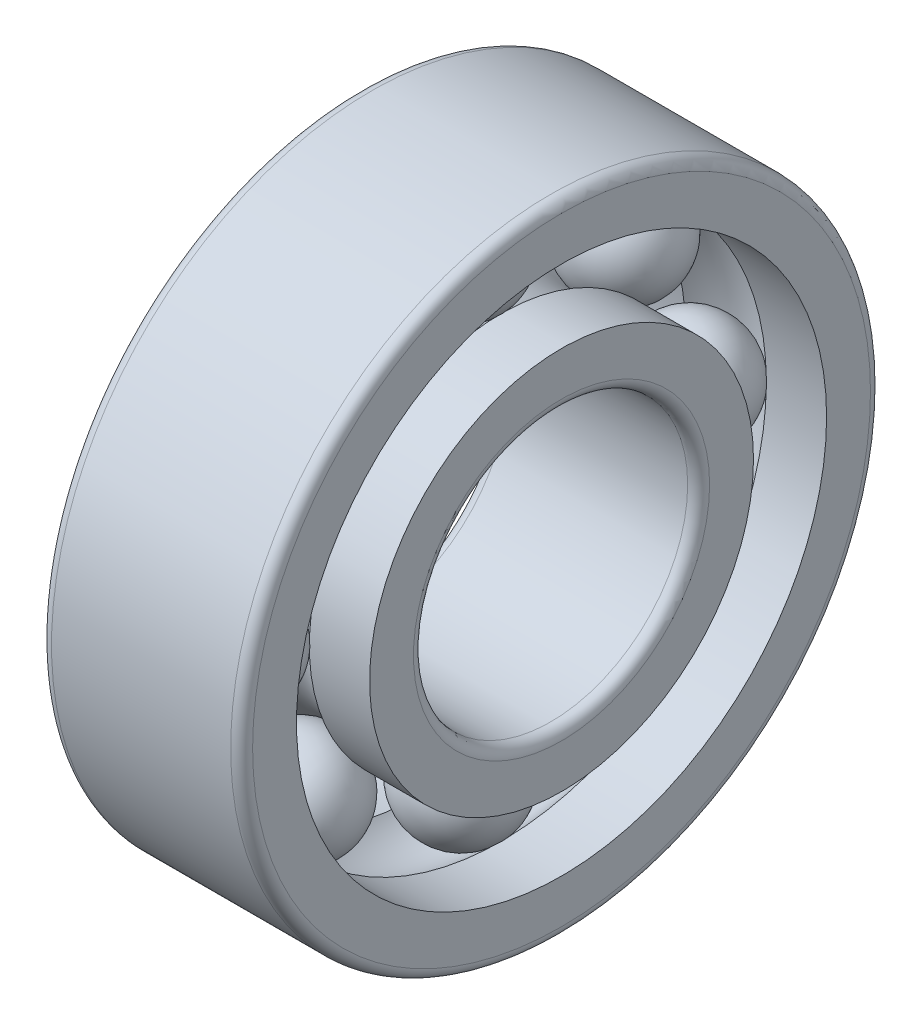
from build123d import *

# Parameters (mm, degrees)
R_P_TITION_CIRCULAIRE1_COUNT = 8


with BuildPart() as part:
    # BalDetSke → BallDetailed (revolve)
    with BuildSketch(Plane.XY):
        with BuildLine():
            Line((-3, 12.5), (3, 12.5))
            ThreePointArc((3, 12.5), (0, 9.5), (-3, 12.5))
        make_face()
    revolve(axis=Axis((-1.905, 12.5, 0), (1, 0, 0)))


with BuildPart() as body_2:
    # InnRacSke → InnerRace (revolve)
    with BuildSketch(Plane.XY):
        with BuildLine():
            Line((-2.202413449, 10.5), (-5.5, 10.5))
            Line((-5.5, 10.5), (-5.5, 8.1))
            ThreePointArc((-5.5, 8.1), (-5.324264069, 7.675735931), (-4.9, 7.5))
            Line((-4.9, 7.5), (4.9, 7.5))
            ThreePointArc((4.9, 7.5), (5.324264069, 7.675735931), (5.5, 8.1))
            Line((5.5, 8.1), (5.5, 10.5))
            Line((5.5, 10.5), (2.202413449, 10.5))
            ThreePointArc((2.202413449, 10.5), (0, 9.525), (-2.202413449, 10.5))
        make_face()
    revolve(axis=Axis((-20.6375, 0, 0), (1, 0, 0)))


with BuildPart() as body_3:
    # OutRacSke → OuterRace (revolve)
    with BuildSketch(Plane.XY):
        with BuildLine():
            Line((-2.202413449, 14.5), (-5.5, 14.5))
            Line((-5.5, 14.5), (-5.5, 16.9))
            ThreePointArc((-5.5, 16.9), (-5.324264069, 17.324264069), (-4.9, 17.5))
            Line((-4.9, 17.5), (4.9, 17.5))
            ThreePointArc((4.9, 17.5), (5.324264069, 17.324264069), (5.5, 16.9))
            Line((5.5, 16.9), (5.5, 14.5))
            Line((5.5, 14.5), (2.202413449, 14.5))
            ThreePointArc((2.202413449, 14.5), (0, 15.475), (-2.202413449, 14.5))
        make_face()
    revolve(axis=Axis((-20.6375, 0, 0), (1, 0, 0)))


with BuildPart() as r_p_tition_circulaire1_1:
    # Répétition circulaire1: pattern copy
    add(part.part.rotate(Axis((-20.6375, 0, 0), (1, 0, 0)), 1 * 360 / R_P_TITION_CIRCULAIRE1_COUNT))


with BuildPart() as r_p_tition_circulaire1_2:
    # Répétition circulaire1: pattern copy
    add(part.part.rotate(Axis((-20.6375, 0, 0), (1, 0, 0)), 2 * 360 / R_P_TITION_CIRCULAIRE1_COUNT))


with BuildPart() as r_p_tition_circulaire1_3:
    # Répétition circulaire1: pattern copy
    add(part.part.rotate(Axis((-20.6375, 0, 0), (1, 0, 0)), 3 * 360 / R_P_TITION_CIRCULAIRE1_COUNT))


with BuildPart() as r_p_tition_circulaire1_4:
    # Répétition circulaire1: pattern copy
    add(part.part.rotate(Axis((-20.6375, 0, 0), (1, 0, 0)), 4 * 360 / R_P_TITION_CIRCULAIRE1_COUNT))


with BuildPart() as r_p_tition_circulaire1_5:
    # Répétition circulaire1: pattern copy
    add(part.part.rotate(Axis((-20.6375, 0, 0), (1, 0, 0)), 5 * 360 / R_P_TITION_CIRCULAIRE1_COUNT))


with BuildPart() as r_p_tition_circulaire1_6:
    # Répétition circulaire1: pattern copy
    add(part.part.rotate(Axis((-20.6375, 0, 0), (1, 0, 0)), 6 * 360 / R_P_TITION_CIRCULAIRE1_COUNT))


with BuildPart() as r_p_tition_circulaire1_7:
    # Répétition circulaire1: pattern copy
    add(part.part.rotate(Axis((-20.6375, 0, 0), (1, 0, 0)), 7 * 360 / R_P_TITION_CIRCULAIRE1_COUNT))


solid = Compound([part.part, body_2.part, body_3.part, r_p_tition_circulaire1_1.part, r_p_tition_circulaire1_2.part, r_p_tition_circulaire1_3.part, r_p_tition_circulaire1_4.part, r_p_tition_circulaire1_5.part, r_p_tition_circulaire1_6.part, r_p_tition_circulaire1_7.part])
